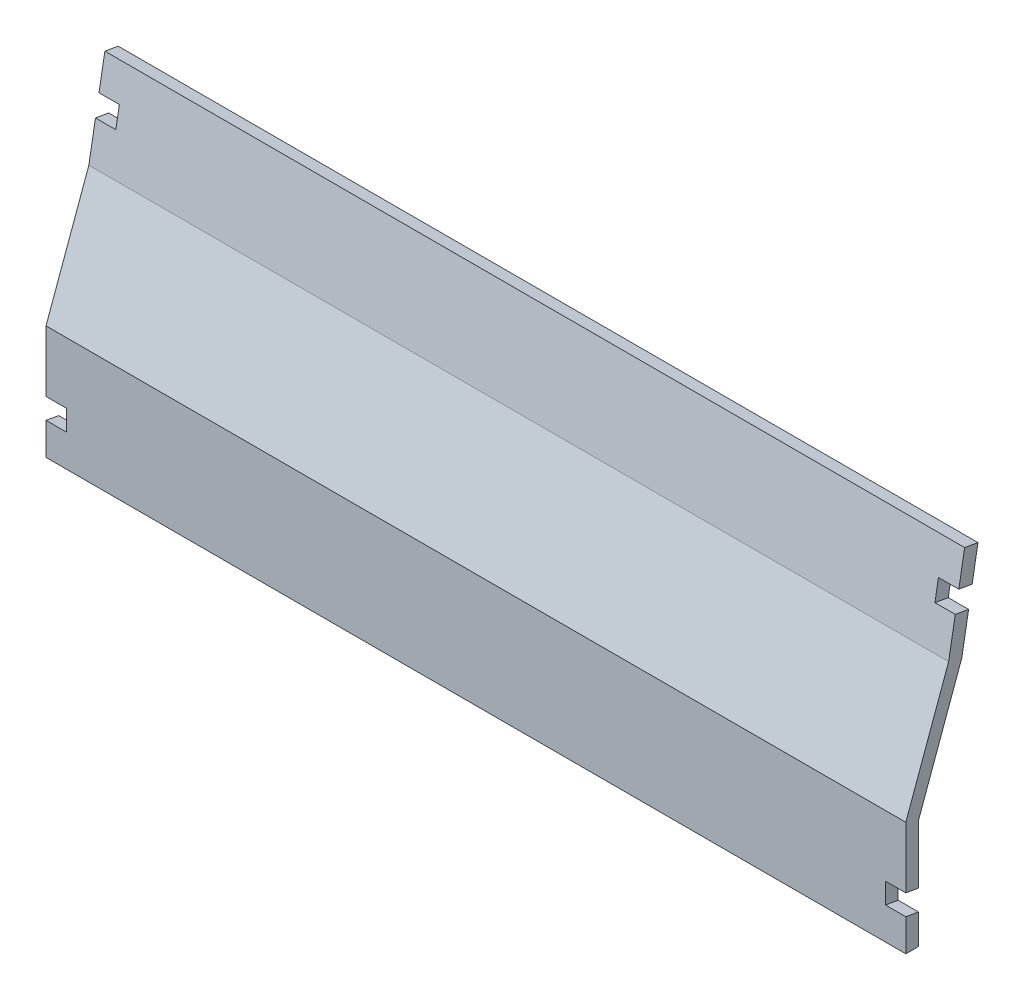
from build123d import *

# Parameters (mm, degrees)
BOSS_EXTRUDE1_DEPTH = 322.072
CUT_EXTRUDE7_DEPTH  = 7.62
CUT_EXTRUDE8_DEPTH  = 7.62


with BuildPart() as part:
    # Sketch1 → Boss-Extrude1 (new body)
    with BuildSketch(Plane(origin=(0, 0, 0), x_dir=(0, 0, -1), z_dir=(1, 0, 0))):
        Polygon((222.810908306, 3.815774726), (227.813731692, 2.933641983), (221.740192501, -31.511110409), (205.541500449, -76.016651046), (205.541500449, -116.964716492), (200.767861936, -116.964716492), (200.767861936, -74.279188718), (216.814545731, -30.191287334), align=None)
    extrude(amount=BOSS_EXTRUDE1_DEPTH)

    # Sketch9 → Cut-Extrude7 (cut)
    with BuildSketch(Plane.ZY):
        Polygon((-228.475043657, -9.983148353), (-213.466573501, -7.336750125), (-212.143374387, -14.840985203), (-227.151844543, -17.487383431), align=None)
        Polygon((-209.00723387, -98.644141931), (-193.998763714, -95.997743703), (-193.998763714, -103.735294485), (-207.684034756, -106.148377008), align=None)
    extrude(amount=-CUT_EXTRUDE7_DEPTH, mode=Mode.SUBTRACT)

    # Sketch10 → Cut-Extrude8 (cut)
    with BuildSketch(Plane(origin=(322.072, 0, 0), x_dir=(0, 0, -1), z_dir=(1, 0, 0))):
        Polygon((228.475043657, -9.983148353), (213.466573501, -7.336750125), (212.143374387, -14.840985203), (227.151844543, -17.487383431), align=None)
        Polygon((193.998763714, -103.735294485), (207.684034756, -106.148377008), (209.00723387, -98.644141931), (193.998763714, -95.997743703), align=None)
    extrude(amount=-CUT_EXTRUDE8_DEPTH, mode=Mode.SUBTRACT)


solid = part.part
